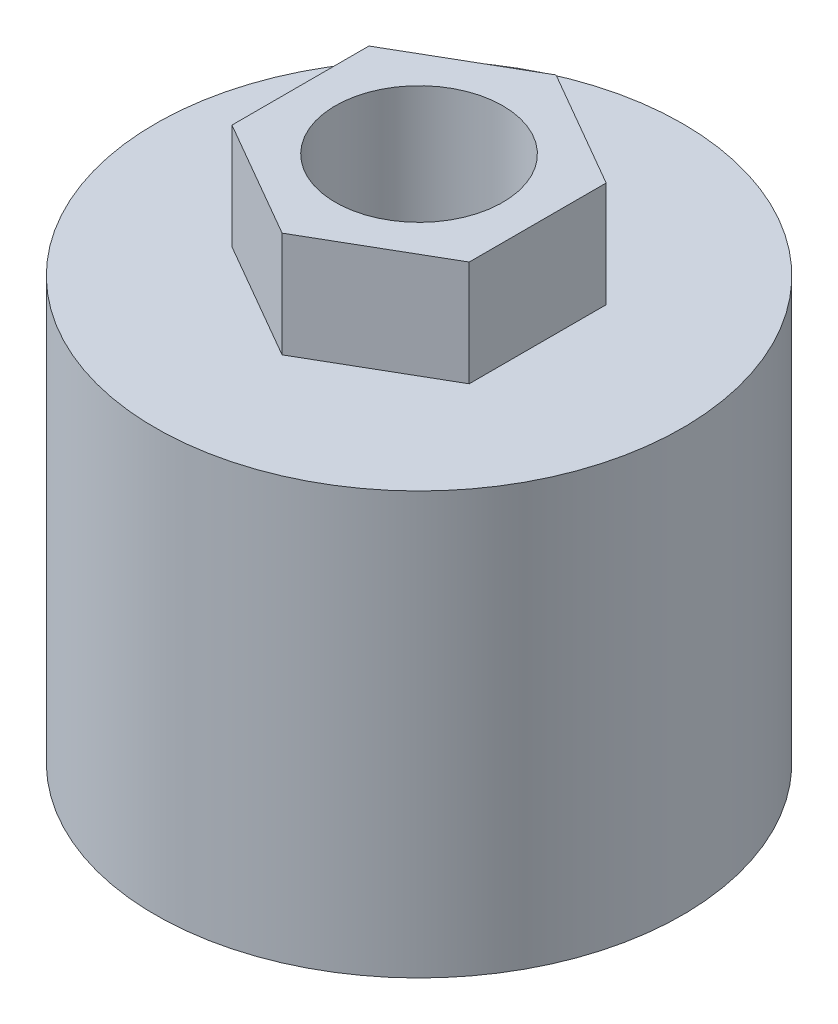
from build123d import *

# Parameters (mm, degrees)
SKETCH1_W           = 10.8331
SKETCH1_H           = 25.4
CUT_EXTRUDE1_DEPTH  = 9.525
BOSS_EXTRUDE1_DEPTH = 6.35
SKETCH5_R           = 5.0419
CUT_EXTRUDE2_DEPTH  = 34.89972345


with BuildPart() as part:
    # Sketch1 → Revolve1 (revolve)
    with BuildSketch(Plane.XY, mode=Mode.PRIVATE) as revolve1_sk:
        with Locations((10.45845, 12.7)):
            Rectangle(SKETCH1_W, SKETCH1_H)
    revolve(revolve1_sk.sketch.rotate(Axis((0, 0, 0), (0, 1, 0)), 90), axis=Axis((0, 0, 0), (0, 1, 0)))

    # Sketch3 → Cut-Extrude1 (cut)
    with BuildSketch(Plane.XZ):
        Polygon((7.62, -4.399409051), (7.62, 4.399409051), (0, 8.798818102), (-7.62, 4.399409051), (-7.62, -4.399409051), (0, -8.798818102), align=None)
    extrude(amount=-CUT_EXTRUDE1_DEPTH, mode=Mode.SUBTRACT)

    # Sketch4 → Boss-Extrude1 (add)
    with BuildSketch(Plane(origin=(0, 25.4, 0), x_dir=(1, 0, 0), z_dir=(0, 1, 0))):
        Polygon((0, 8.248891971), (-7.14375, 4.124445986), (-7.14375, -4.124445986), (0, -8.248891971), (7.14375, -4.124445986), (7.14375, 4.124445986), align=None)
    extrude(amount=BOSS_EXTRUDE1_DEPTH)

    # Sketch5 → Cut-Extrude2 (cut, through all)
    with BuildSketch(Plane.XZ.offset(-25.4)):
        with Locations(Location((0, 0, 0), (0, 0, 270))):
            Circle(SKETCH5_R)
    extrude(amount=-CUT_EXTRUDE2_DEPTH, mode=Mode.SUBTRACT)


solid = part.part
